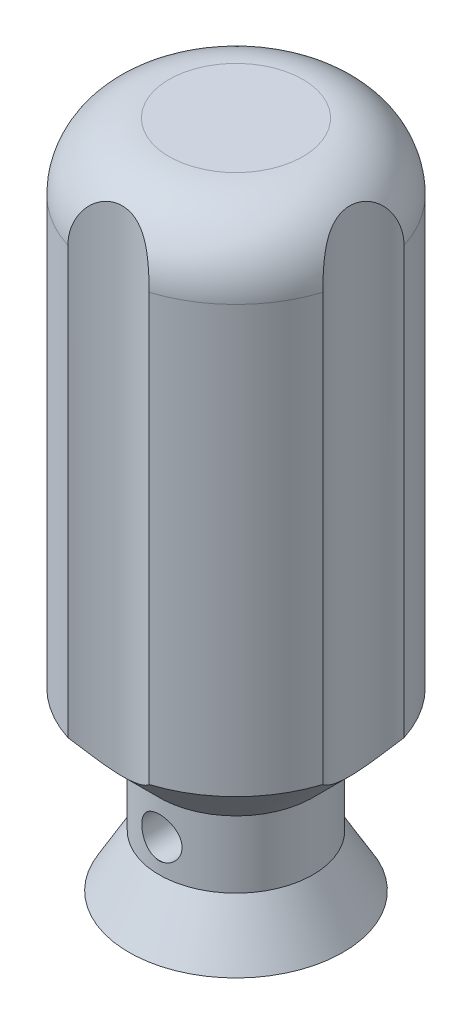
from build123d import *

# Parameters (mm, degrees)
SKETCH3_R                       = 10
CUT_EXTRUDE1_DEPTH              = 104.923048473
F_6_0MM_DOWEL_HOLE1_D           = 6
F_6_0MM_DOWEL_HOLE1_CSINK_D     = 6.05
F_6_0MM_DOWEL_HOLE1_CSINK_ANGLE = 90


with BuildPart() as part:
    # Sketch2 → Revolve1 (revolve)
    with BuildSketch(Plane.XY, mode=Mode.PRIVATE) as revolve1_sk:
        with BuildLine():
            Line((4, 0), (4, 30))
            Line((4, 30), (0, 30))
            Line((0, 30), (0, 100))
            Line((0, 100), (10, 100))
            ThreePointArc((10, 100), (17.071067812, 97.071067812), (20, 90))
            Line((20, 90), (20, 26.294228634))
            Line((20, 26.294228634), (11.5, 17.794228634))
            Line((11.5, 17.794228634), (11.5, 7.794228634))
            Line((11.5, 7.794228634), (16, 0))
            Line((16, 0), (4, 0))
        make_face()
    revolve(revolve1_sk.sketch.rotate(Axis((0, 30, 0), (0, 1, 0)), 90), axis=Axis((0, 30, 0), (0, 1, 0)))

    # Sketch3 → Cut-Extrude1 (cut, through all)
    with BuildSketch(Plane.XZ):
        with Locations((0, 27)):
            Circle(SKETCH3_R)
        with Locations((27, 0)):
            Circle(SKETCH3_R)
        with Locations((0, -27)):
            Circle(SKETCH3_R)
        with Locations((-27, 0)):
            Circle(SKETCH3_R)
    extrude(amount=-CUT_EXTRUDE1_DEPTH, mode=Mode.SUBTRACT)

    # Ø6.0mm Dowel Hole1 (through all)
    with Locations(Plane(origin=(0.030615993, 12.647260725, 11.499959246), x_dir=(0.999996456179, 0, -0.002662260256), z_dir=(0.002662260256, 0, 0.999996456179))):
        with Locations((0, 0)):
            CounterSinkHole(F_6_0MM_DOWEL_HOLE1_D / 2, F_6_0MM_DOWEL_HOLE1_CSINK_D / 2, counter_sink_angle=F_6_0MM_DOWEL_HOLE1_CSINK_ANGLE)


solid = part.part
